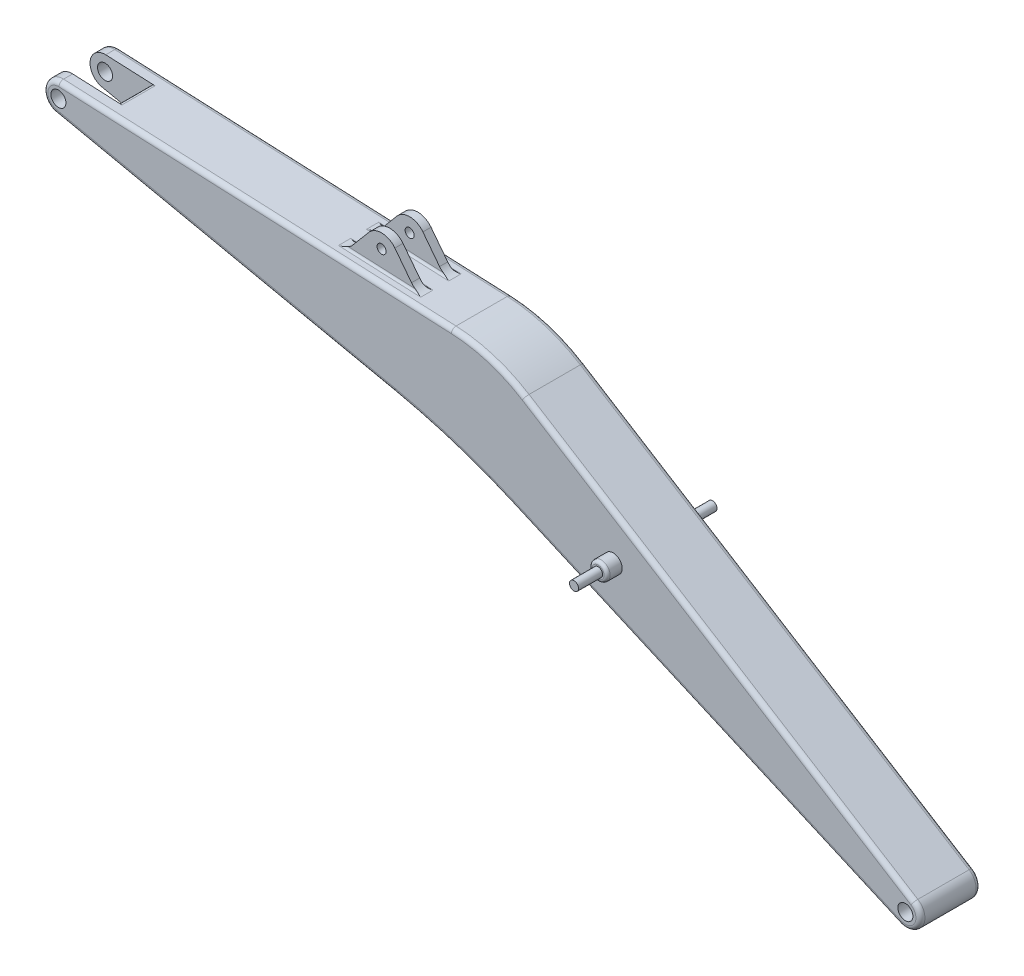
from build123d import *

# Parameters (mm, degrees)
BOSS_EXTRUDE1_DEPTH      = 508
FILLET1_R                = 1270
FILLET2_R                = 5080
SKETCH2_R                = 63.5
BOSS_EXTRUDE2_DEPTH      = 508
FILLET7_R                = 38.1
SKETCH8_R                = 76.2
BOSS_EXTRUDE3_DEPTH      = 127
SKETCH10_R               = 38.1
BOSS_EXTRUDE4_DEPTH      = 152.4
SKETCH11_W               = 760.745095085
SKETCH11_H               = 167.893028408
CUT_EXTRUDE10_DEPTH      = 304.8
FILLET8_R                = 127
FILLET9_R                = 17.78
CUT_EXTRUDE11_DEPTH      = 7199.486465925
CUT_EXTRUDE11_DEPTH_BACK = 7199.486465925
SKETCH12_W               = 1016
SKETCH12_H               = 279.4
FILLET10_R               = 35.56
SKETCH13_R               = 38.1
BOSS_EXTRUDE5_DEPTH      = 203.2
FILLET11_R               = 25.4


with BuildPart() as part:
    # Sketch1 → Boss-Extrude1 (new body)
    with BuildSketch(Plane.XY):
        Polygon((4.161043322, 1419.774180046), (3124.883876206, 1280.150261915), (4824.15316033, 218.45444974), (4595.126937627, -303.484366054), (2819.668835365, 475.584847472), (4.161043322, 1074.039503103), align=None)
    extrude(amount=BOSS_EXTRUDE1_DEPTH)

    # Fillet1
    fillet1_edges = [part.edges().sort_by_distance(p)[0] for p in [
        (3124.883876206, 1280.150261915, 254),
    ]]
    fillet(fillet1_edges, radius=FILLET1_R)

    # Fillet2
    fillet2_edges = [part.edges().sort_by_distance(p)[0] for p in [
        (2819.668835365, 475.584847472, 254),
    ]]
    fillet(fillet2_edges, radius=FILLET2_R)

    # Sketch2 → Boss-Extrude2 (add)
    # profile 1 of 2: a face of its own
    with BuildSketch(Plane.XY.offset(508)):
        with BuildLine():
            Line((4824.15316033, 218.45444974), (6687.157756782, -945.542449749))
            ThreePointArc((6687.157756782, -945.542449749), (6732.159594174, -1112.566249031), (6568.832971244, -1169.544570675))
            Line((6568.832971244, -1169.544570675), (4595.126937627, -303.484366054))
            Line((4595.126937627, -303.484366054), (4824.15316033, 218.45444974))
        make_face()
        with Locations((6619.863730452, -1053.248132145)):
            Circle(SKETCH2_R, mode=Mode.SUBTRACT)
    # profile 2 of 2: a face of its own
    with BuildSketch(Plane.XY.offset(508)):
        with BuildLine():
            Line((-519.138014459, 1443.18704582), (4.161043322, 1419.774180046))
            Line((4.161043322, 1419.774180046), (4.161043322, 1074.039503103))
            Line((4.161043322, 1074.039503103), (-551.219213736, 1192.089220963))
            ThreePointArc((-551.219213736, 1192.089220963), (-650.790401888, 1332.40912874), (-519.138014459, 1443.18704582))
        make_face()
        with Locations((-524.814429002, 1316.313966256)):
            Circle(SKETCH2_R, mode=Mode.SUBTRACT)
    extrude(amount=-BOSS_EXTRUDE2_DEPTH)

    # Fillet7
    fillet7_edges = [part.edges().sort_by_distance(p)[0] for p in [
        (879.847598956, 887.906579737, 508),
        (5047.477930293, 78.922137092, 0),
        (3112.087026658, 1239.012109425, 0),
        (5047.477930293, 78.922137092, 508),
        (3112.087026658, 1239.012109425, 508),
        (4932.393180935, -451.476451357, 0),
        (4932.393180935, -451.476451357, 508),
        (2811.530205443, 450.305591926, 0),
        (2811.530205443, 450.305591926, 508),
        (1136.24198574, 1369.123870715, 508),
        (-650.790401888, 1332.40912874, 0),
        (-650.790401888, 1332.40912874, 508),
        (6732.159594174, -1112.566249031, 0),
        (6732.159594174, -1112.566249031, 508),
        (1136.24198574, 1369.123870715, 0),
        (879.847598956, 887.906579737, 0),
    ]]
    fillet(fillet7_edges, radius=FILLET7_R)

    # Sketch8 → Boss-Extrude3 (add)
    with BuildSketch(Plane.XY.offset(508)):
        with Locations((4154.847226234, 262.095790155)):
            Circle(SKETCH8_R)
    boss_extrude3 = extrude(amount=BOSS_EXTRUDE3_DEPTH)

    # Mirror1: Boss-Extrude3 across plane
    add(boss_extrude3.mirror(Plane.XY.offset(254)))

    # Sketch10 → Boss-Extrude4 (add, symmetric)
    with BuildSketch(Plane.XY.offset(254)):
        with BuildLine():
            Line((1991.886254442, 1547.436985797), (1816.197026703, 1338.702076773))
            Line((1816.197026703, 1338.702076773), (2388.527398841, 1313.09550634))
            Line((2388.527398841, 1313.09550634), (2212.068885606, 1542.577547744))
            ThreePointArc((2212.068885606, 1542.577547744), (2103.141108974, 1597.727574068), (1991.886254442, 1547.436985797))
        make_face()
        with Locations(Location((2100.022452123, 1480.032783348, 0), (0, 0, 180))):
            Circle(SKETCH10_R, mode=Mode.SUBTRACT)
    extrude(amount=BOSS_EXTRUDE4_DEPTH, both=True)

    # Sketch11 → Cut-Extrude10 (cut)
    with BuildSketch(Plane(origin=(63.403372764, 1417.12362548, 0), x_dir=(0.9990006264844701, -0.04469617750587411, 0), z_dir=(0.04469617750587411, 0.9990006264844701, 0))):
        with Locations((2022.884228843, -254)):
            Rectangle(SKETCH11_W, SKETCH11_H)
    extrude(amount=CUT_EXTRUDE10_DEPTH, mode=Mode.SUBTRACT)

    # Fillet8
    fillet8_edges = [part.edges().sort_by_distance(p)[0] for p in [
        (1816.197026703, 1338.702076773, 372.173257102),
        (2388.527398841, 1313.09550634, 372.173257102),
        (2388.527398841, 1313.09550634, 135.826742898),
        (1816.197026703, 1338.702076773, 135.826742898),
    ]]
    fillet(fillet8_edges, radius=FILLET8_R)

    # Fillet9
    fillet9_edges = [part.edges().sort_by_distance(p)[0] for p in [
        (2100.596165657, 1325.977806077, 101.6),
        (2100.596165657, 1325.977806077, 406.4),
        (2100.596165657, 1325.977806077, 337.946514204),
        (2100.596165657, 1325.977806077, 170.053485796),
    ]]
    fillet(fillet9_edges, radius=FILLET9_R)

    # Sketch12 → Cut-Extrude11 (cut, two sides: drawn at the far end of the back side and taken through both)
    with BuildSketch(Plane(origin=(63.403372764, 1417.12362548, 0), x_dir=(0.99900062648447, -0.04469617750587411, 0), z_dir=(0.04469617750587411, 0.9990006264844701, 0)).offset(-CUT_EXTRUDE11_DEPTH_BACK)):
        with Locations((-710.12414605, -254)):
            Rectangle(SKETCH12_W, SKETCH12_H)
    extrude(amount=CUT_EXTRUDE11_DEPTH + CUT_EXTRUDE11_DEPTH_BACK, mode=Mode.SUBTRACT)

    # Fillet10
    fillet10_edges = [part.edges().sort_by_distance(p)[0] for p in [
        (-138.518775768, 1426.15780219, 254),
        (-152.780354031, 1107.398426908, 254),
    ]]
    fillet(fillet10_edges, radius=FILLET10_R)

    # Sketch13 → Boss-Extrude5 (add)
    with BuildSketch(Plane.XY.offset(635)):
        with Locations((4154.847226234, 262.095790155)):
            Circle(SKETCH13_R)
    boss_extrude5 = extrude(amount=BOSS_EXTRUDE5_DEPTH)

    # Mirror3: Boss-Extrude5 across plane
    add(boss_extrude5.mirror(Plane.XY.offset(254)))

    # Fillet11
    fillet11_edges = [part.edges().sort_by_distance(p)[0] for p in [
        (4078.647226234, 262.095790155, 635),
        (4078.647226234, 262.095790155, -127),
    ]]
    fillet(fillet11_edges, radius=FILLET11_R)


solid = part.part
